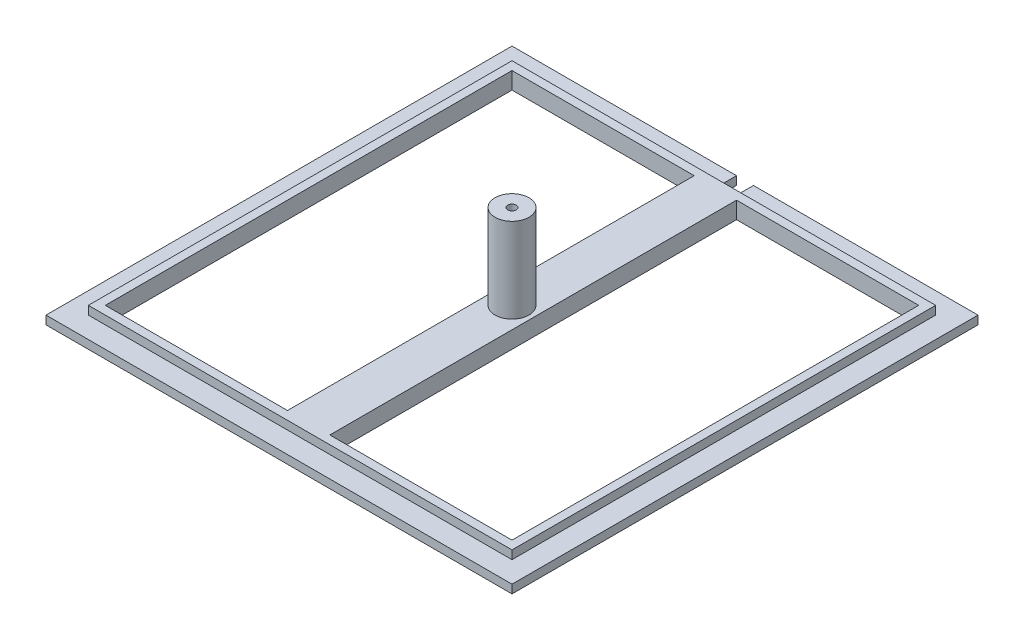
from build123d import *

# Parameters (mm, degrees)
CROQUIS1_W              = 110
CROQUIS1_H              = 110
CROQUIS1_W_2            = 100
CROQUIS1_H_2            = 100
SALIENTE_EXTRUIR1_DEPTH = 2
CROQUIS2_W              = 100
CROQUIS2_H              = 100
CROQUIS2_W_2            = 96
CROQUIS2_H_2            = 96
SALIENTE_EXTRUIR2_DEPTH = 4
CROQUIS3_W              = 10
CROQUIS3_H              = 96
SALIENTE_EXTRUIR3_DEPTH = 4
CROQUIS4_R              = 4
CROQUIS4_R_2            = 1
SALIENTE_EXTRUIR4_DEPTH = 20
CORTAR_EXTRUIR1_START   = -20
CROQUIS5_R              = 1
CORTAR_EXTRUIR1_DEPTH   = 20
CROQUIS6_W              = 4
CROQUIS6_H              = 2
CORTAR_EXTRUIR4_DEPTH   = 55


with BuildPart() as part:
    # Croquis1 → Saliente-Extruir1 (new body)
    with BuildSketch(Plane(origin=(0, 0, 0), x_dir=(1, 0, 0), z_dir=(0, 1, 0))):
        with Locations((50, 50)):
            Rectangle(CROQUIS1_W, CROQUIS1_H)
        with Locations((50, 50)):
            Rectangle(CROQUIS1_W_2, CROQUIS1_H_2, mode=Mode.SUBTRACT)
    extrude(amount=SALIENTE_EXTRUIR1_DEPTH)

    # Croquis2 → Saliente-Extruir2 (add)
    with BuildSketch(Plane.XZ):
        with Locations((50, -50)):
            Rectangle(CROQUIS2_W, CROQUIS2_H)
        with Locations((50, -50)):
            Rectangle(CROQUIS2_W_2, CROQUIS2_H_2, mode=Mode.SUBTRACT)
    extrude(amount=-SALIENTE_EXTRUIR2_DEPTH)

    # Croquis3 → Saliente-Extruir3 (add)
    with BuildSketch(Plane.XZ):
        with Locations((50, -50)):
            Rectangle(CROQUIS3_W, CROQUIS3_H)
    extrude(amount=-SALIENTE_EXTRUIR3_DEPTH)

    # Croquis4 → Saliente-Extruir4 (add)
    with BuildSketch(Plane(origin=(0, 4, 0), x_dir=(1, 0, 0), z_dir=(0, 1, 0))):
        with Locations(Location((50, 50, 0), (0, 0, 270))):
            Circle(CROQUIS4_R)
        with Locations(Location((50, 50, 0), (0, 0, 270))):
            Circle(CROQUIS4_R_2, mode=Mode.SUBTRACT)
    extrude(amount=SALIENTE_EXTRUIR4_DEPTH)

    # Croquis5 → Cortar-Extruir1 (cut)
    with BuildSketch(Plane(origin=(0, 4, 0), x_dir=(1, 0, 0), z_dir=(0, 1, 0)).offset(CORTAR_EXTRUIR1_START)):
        with Locations(Location((50, 50, 0), (0, 0, 270))):
            Circle(CROQUIS5_R)
    extrude(amount=CORTAR_EXTRUIR1_DEPTH, mode=Mode.SUBTRACT)

    # Croquis6 → Cortar-Extruir4 (cut)
    with BuildSketch(Plane(origin=(0, 0, -105), x_dir=(-1, 0, 0), z_dir=(0, 0, -1))):
        with Locations((-50, 1)):
            Rectangle(CROQUIS6_W, CROQUIS6_H)
    extrude(amount=-CORTAR_EXTRUIR4_DEPTH, mode=Mode.SUBTRACT)


solid = part.part
